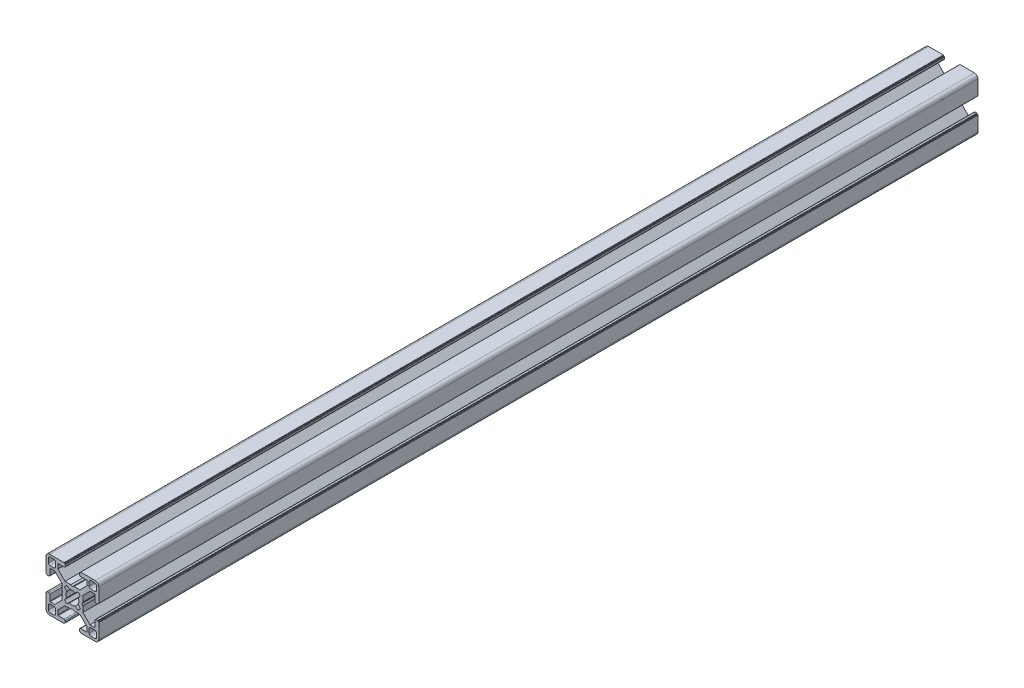
from build123d import *

# Parameters (mm, degrees)
BASE_EXTRUDE_DEPTH = 500


with BuildPart() as part:
    # Sketch1 → Base-Extrude (new body)
    with BuildSketch(Plane.XY):
        with BuildLine():
            Line((6.00446543, 0.899999619), (5.484852164, 0))
            Line((5.484852164, 0), (6.00446543, -0.899999619))
            Line((6.00446543, -0.899999619), (6.00446543, -4.204465866))
            Line((6.00446543, -4.204465866), (10.049999564, -8.25))
            Line((10.049999564, -8.25), (12.59999928, -8.25))
            ThreePointArc((12.59999928, -8.25), (12.741420837, -8.191421273), (12.799999564, -8.049999716))
            Line((12.799999564, -8.049999716), (12.799999564, -4.649999613))
            ThreePointArc((12.799999564, -4.649999613), (12.975735606, -4.225735278), (13.39999994, -4.049999237))
            Line((13.39999994, -4.049999237), (14.300000043, -4.049999237))
            ThreePointArc((14.300000043, -4.049999237), (14.4414216, -4.108577964), (14.500000327, -4.249999521))
            Line((14.500000327, -4.249999521), (14.500000327, -4.349998953))
            ThreePointArc((14.500000327, -4.349998953), (14.558579054, -4.49142051), (14.700000611, -4.549999237))
            Line((14.700000611, -4.549999237), (14.799999716, -4.549999237))
            ThreePointArc((14.799999716, -4.549999237), (14.941421273, -4.608577964), (15, -4.749999521))
            Line((15, -4.749999521), (15, -13.000000346))
            ThreePointArc((15, -13.000000346), (14.414213664, -14.414213664), (13.000000346, -15))
            Line((13.000000346, -15), (4.749999945, -15))
            ThreePointArc((4.749999945, -15), (4.60857832, -14.941421245), (4.549999564, -14.799999619))
            Line((4.549999564, -14.799999619), (4.549999564, -14.69999942))
            ThreePointArc((4.549999564, -14.69999942), (4.49142109, -14.558578474), (4.350000144, -14.5))
            Line((4.350000144, -14.5), (4.250000374, -14.5))
            ThreePointArc((4.250000374, -14.5), (4.108578753, -14.441421247), (4.05, -14.299999626))
            Line((4.05, -14.299999626), (4.05, -13.399999434))
            ThreePointArc((4.05, -13.399999434), (4.225735989, -12.975735226), (4.650000197, -12.799999237))
            Line((4.650000197, -12.799999237), (8.049999924, -12.799999237))
            ThreePointArc((8.049999924, -12.799999237), (8.191421565, -12.741420475), (8.250000327, -12.599998834))
            Line((8.250000327, -12.599998834), (8.250000327, -10.049999237))
            Line((8.250000327, -10.049999237), (4.204466193, -6))
            Line((4.204466193, -6), (0.899999946, -6))
            Line((0.899999946, -6), (0, -5.484851837))
            Line((0, -5.484851837), (-0.899999946, -6))
            Line((-0.899999946, -6), (-4.204466193, -6))
            Line((-4.204466193, -6), (-8.250000327, -10.049999237))
            Line((-8.250000327, -10.049999237), (-8.250000327, -12.599998834))
            ThreePointArc((-8.250000327, -12.599998834), (-8.191421565, -12.741420475), (-8.049999924, -12.799999237))
            Line((-8.049999924, -12.799999237), (-4.650000197, -12.799999237))
            ThreePointArc((-4.650000197, -12.799999237), (-4.225735989, -12.975735226), (-4.05, -13.399999434))
            Line((-4.05, -13.399999434), (-4.05, -14.299999626))
            ThreePointArc((-4.05, -14.299999626), (-4.108578753, -14.441421247), (-4.250000374, -14.5))
            Line((-4.250000374, -14.5), (-4.350000144, -14.5))
            ThreePointArc((-4.350000144, -14.5), (-4.49142109, -14.558578474), (-4.549999564, -14.69999942))
            Line((-4.549999564, -14.69999942), (-4.549999564, -14.799999619))
            ThreePointArc((-4.549999564, -14.799999619), (-4.60857832, -14.941421245), (-4.749999945, -15))
            Line((-4.749999945, -15), (-13.000000346, -15))
            ThreePointArc((-13.000000346, -15), (-14.414213664, -14.414213664), (-15, -13.000000346))
            Line((-15, -13.000000346), (-15, -4.749999521))
            ThreePointArc((-15, -4.749999521), (-14.941421273, -4.608577964), (-14.799999716, -4.549999237))
            Line((-14.799999716, -4.549999237), (-14.700000611, -4.549999237))
            ThreePointArc((-14.700000611, -4.549999237), (-14.558579054, -4.49142051), (-14.500000327, -4.349998953))
            Line((-14.500000327, -4.349998953), (-14.500000327, -4.249999521))
            ThreePointArc((-14.500000327, -4.249999521), (-14.4414216, -4.108577964), (-14.300000043, -4.049999237))
            Line((-14.300000043, -4.049999237), (-13.39999994, -4.049999237))
            ThreePointArc((-13.39999994, -4.049999237), (-12.975735606, -4.225735278), (-12.799999564, -4.649999613))
            Line((-12.799999564, -4.649999613), (-12.799999564, -8.049999716))
            ThreePointArc((-12.799999564, -8.049999716), (-12.741420837, -8.191421273), (-12.59999928, -8.25))
            Line((-12.59999928, -8.25), (-10.049999564, -8.25))
            Line((-10.049999564, -8.25), (-6.00446543, -4.204465866))
            Line((-6.00446543, -4.204465866), (-6.00446543, -0.899999619))
            Line((-6.00446543, -0.899999619), (-5.484852164, 0))
            Line((-5.484852164, 0), (-6.00446543, 0.899999619))
            Line((-6.00446543, 0.899999619), (-6.00446543, 4.204465866))
            Line((-6.00446543, 4.204465866), (-10.049999564, 8.25))
            Line((-10.049999564, 8.25), (-12.59999928, 8.25))
            ThreePointArc((-12.59999928, 8.25), (-12.741420837, 8.191421273), (-12.799999564, 8.049999716))
            Line((-12.799999564, 8.049999716), (-12.799999564, 4.649999613))
            ThreePointArc((-12.799999564, 4.649999613), (-12.975735606, 4.225735278), (-13.39999994, 4.049999237))
            Line((-13.39999994, 4.049999237), (-14.300000043, 4.049999237))
            ThreePointArc((-14.300000043, 4.049999237), (-14.4414216, 4.108577964), (-14.500000327, 4.249999521))
            Line((-14.500000327, 4.249999521), (-14.500000327, 4.349998953))
            ThreePointArc((-14.500000327, 4.349998953), (-14.558579054, 4.49142051), (-14.700000611, 4.549999237))
            Line((-14.700000611, 4.549999237), (-14.799999716, 4.549999237))
            ThreePointArc((-14.799999716, 4.549999237), (-14.941421273, 4.608577964), (-15, 4.749999521))
            Line((-15, 4.749999521), (-15, 13.000000346))
            ThreePointArc((-15, 13.000000346), (-14.414213664, 14.414213664), (-13.000000346, 15))
            Line((-13.000000346, 15), (-4.749999945, 15))
            ThreePointArc((-4.749999945, 15), (-4.60857832, 14.941421245), (-4.549999564, 14.799999619))
            Line((-4.549999564, 14.799999619), (-4.549999564, 14.69999942))
            ThreePointArc((-4.549999564, 14.69999942), (-4.49142109, 14.558578474), (-4.350000144, 14.5))
            Line((-4.350000144, 14.5), (-4.250000374, 14.5))
            ThreePointArc((-4.250000374, 14.5), (-4.108578753, 14.441421247), (-4.05, 14.299999626))
            Line((-4.05, 14.299999626), (-4.05, 13.399999434))
            ThreePointArc((-4.05, 13.399999434), (-4.225735989, 12.975735226), (-4.650000197, 12.799999237))
            Line((-4.650000197, 12.799999237), (-8.049999924, 12.799999237))
            ThreePointArc((-8.049999924, 12.799999237), (-8.191421565, 12.741420475), (-8.250000327, 12.599998834))
            Line((-8.250000327, 12.599998834), (-8.250000327, 10.049999237))
            Line((-8.250000327, 10.049999237), (-4.204466193, 6))
            Line((-4.204466193, 6), (-0.899999946, 6))
            Line((-0.899999946, 6), (0, 5.484851837))
            Line((0, 5.484851837), (0.899999946, 6))
            Line((0.899999946, 6), (4.204466193, 6))
            Line((4.204466193, 6), (8.250000327, 10.049999237))
            Line((8.250000327, 10.049999237), (8.250000327, 12.599998834))
            ThreePointArc((8.250000327, 12.599998834), (8.191421565, 12.741420475), (8.049999924, 12.799999237))
            Line((8.049999924, 12.799999237), (4.650000197, 12.799999237))
            ThreePointArc((4.650000197, 12.799999237), (4.225735989, 12.975735226), (4.05, 13.399999434))
            Line((4.05, 13.399999434), (4.05, 14.299999626))
            ThreePointArc((4.05, 14.299999626), (4.108578753, 14.441421247), (4.250000374, 14.5))
            Line((4.250000374, 14.5), (4.350000144, 14.5))
            ThreePointArc((4.350000144, 14.5), (4.49142109, 14.558578474), (4.549999564, 14.69999942))
            Line((4.549999564, 14.69999942), (4.549999564, 14.799999619))
            ThreePointArc((4.549999564, 14.799999619), (4.60857832, 14.941421245), (4.749999945, 15))
            Line((4.749999945, 15), (13.000000346, 15))
            ThreePointArc((13.000000346, 15), (14.414213664, 14.414213664), (15, 13.000000346))
            Line((15, 13.000000346), (15, 4.749999521))
            ThreePointArc((15, 4.749999521), (14.941421273, 4.608577964), (14.799999716, 4.549999237))
            Line((14.799999716, 4.549999237), (14.700000611, 4.549999237))
            ThreePointArc((14.700000611, 4.549999237), (14.558579054, 4.49142051), (14.500000327, 4.349998953))
            Line((14.500000327, 4.349998953), (14.500000327, 4.249999521))
            ThreePointArc((14.500000327, 4.249999521), (14.4414216, 4.108577964), (14.300000043, 4.049999237))
            Line((14.300000043, 4.049999237), (13.39999994, 4.049999237))
            ThreePointArc((13.39999994, 4.049999237), (12.975735606, 4.225735278), (12.799999564, 4.649999613))
            Line((12.799999564, 4.649999613), (12.799999564, 8.049999716))
            ThreePointArc((12.799999564, 8.049999716), (12.741420837, 8.191421273), (12.59999928, 8.25))
            Line((12.59999928, 8.25), (10.049999564, 8.25))
            Line((10.049999564, 8.25), (6.00446543, 4.204465866))
            Line((6.00446543, 4.204465866), (6.00446543, 0.899999619))
        make_face()
        with BuildLine():
            Line((13.70000109, 12.700000398), (13.70000109, 10.499999635))
            ThreePointArc((13.70000109, 10.499999635), (13.407107874, 9.792892851), (12.70000109, 9.499999635))
            Line((12.70000109, 9.499999635), (10.500000327, 9.499999635))
            ThreePointArc((10.500000327, 9.499999635), (9.792893543, 9.792892851), (9.500000327, 10.499999635))
            Line((9.500000327, 10.499999635), (9.500000327, 12.700000398))
            ThreePointArc((9.500000327, 12.700000398), (9.792893543, 13.407107182), (10.500000327, 13.700000398))
            Line((10.500000327, 13.700000398), (12.70000109, 13.700000398))
            ThreePointArc((12.70000109, 13.700000398), (13.407107874, 13.407107182), (13.70000109, 12.700000398))
        make_face(mode=Mode.SUBTRACT)
        with BuildLine():
            Line((3.135929412, 4.518400903), (1.600129524, 3.280561767))
            ThreePointArc((1.600129524, 3.280561767), (0, 3.65), (-1.600129524, 3.280561767))
            Line((-1.600129524, 3.280561767), (-3.135929412, 4.518400903))
            ThreePointArc((-3.135929412, 4.518400903), (-3.881002259, 3.897155561), (-4.505336892, 3.154669473))
            Line((-4.505336892, 3.154669473), (-3.280561732, 1.600129597))
            ThreePointArc((-3.280561732, 1.600129597), (-3.65, 0), (-3.280561732, -1.600129597))
            Line((-3.280561732, -1.600129597), (-4.505336892, -3.154669473))
            ThreePointArc((-4.505336892, -3.154669473), (-3.881002259, -3.897155561), (-3.135929412, -4.518400903))
            Line((-3.135929412, -4.518400903), (-1.600129524, -3.280561767))
            ThreePointArc((-1.600129524, -3.280561767), (0, -3.65), (1.600129524, -3.280561767))
            Line((1.600129524, -3.280561767), (3.135929412, -4.518400903))
            ThreePointArc((3.135929412, -4.518400903), (3.881002259, -3.897155561), (4.505336892, -3.154669473))
            Line((4.505336892, -3.154669473), (3.280561732, -1.600129597))
            ThreePointArc((3.280561732, -1.600129597), (3.65, 0), (3.280561732, 1.600129597))
            Line((3.280561732, 1.600129597), (4.505336892, 3.154669473))
            ThreePointArc((4.505336892, 3.154669473), (3.881002259, 3.897155561), (3.135929412, 4.518400903))
        make_face(mode=Mode.SUBTRACT)
        with BuildLine():
            Line((-13.70000109, -12.700000398), (-13.70000109, -10.499999635))
            ThreePointArc((-13.70000109, -10.499999635), (-13.407107874, -9.792892851), (-12.70000109, -9.499999635))
            Line((-12.70000109, -9.499999635), (-10.500000327, -9.499999635))
            ThreePointArc((-10.500000327, -9.499999635), (-9.792893543, -9.792892851), (-9.500000327, -10.499999635))
            Line((-9.500000327, -10.499999635), (-9.500000327, -12.700000398))
            ThreePointArc((-9.500000327, -12.700000398), (-9.792893543, -13.407107182), (-10.500000327, -13.700000398))
            Line((-10.500000327, -13.700000398), (-12.70000109, -13.700000398))
            ThreePointArc((-12.70000109, -13.700000398), (-13.407107874, -13.407107182), (-13.70000109, -12.700000398))
        make_face(mode=Mode.SUBTRACT)
        with BuildLine():
            Line((10.500000327, -13.700000398), (12.70000109, -13.700000398))
            ThreePointArc((12.70000109, -13.700000398), (13.407107874, -13.407107182), (13.70000109, -12.700000398))
            Line((13.70000109, -12.700000398), (13.70000109, -10.499999635))
            ThreePointArc((13.70000109, -10.499999635), (13.407107874, -9.792892851), (12.70000109, -9.499999635))
            Line((12.70000109, -9.499999635), (10.500000327, -9.499999635))
            ThreePointArc((10.500000327, -9.499999635), (9.792893543, -9.792892851), (9.500000327, -10.499999635))
            Line((9.500000327, -10.499999635), (9.500000327, -12.700000398))
            ThreePointArc((9.500000327, -12.700000398), (9.792893543, -13.407107182), (10.500000327, -13.700000398))
        make_face(mode=Mode.SUBTRACT)
        with BuildLine():
            Line((-10.500000327, 13.700000398), (-12.70000109, 13.700000398))
            ThreePointArc((-12.70000109, 13.700000398), (-13.407107874, 13.407107182), (-13.70000109, 12.700000398))
            Line((-13.70000109, 12.700000398), (-13.70000109, 10.499999635))
            ThreePointArc((-13.70000109, 10.499999635), (-13.407107874, 9.792892851), (-12.70000109, 9.499999635))
            Line((-12.70000109, 9.499999635), (-10.500000327, 9.499999635))
            ThreePointArc((-10.500000327, 9.499999635), (-9.792893543, 9.792892851), (-9.500000327, 10.499999635))
            Line((-9.500000327, 10.499999635), (-9.500000327, 12.700000398))
            ThreePointArc((-9.500000327, 12.700000398), (-9.792893543, 13.407107182), (-10.500000327, 13.700000398))
        make_face(mode=Mode.SUBTRACT)
    extrude(amount=-BASE_EXTRUDE_DEPTH)


solid = part.part
